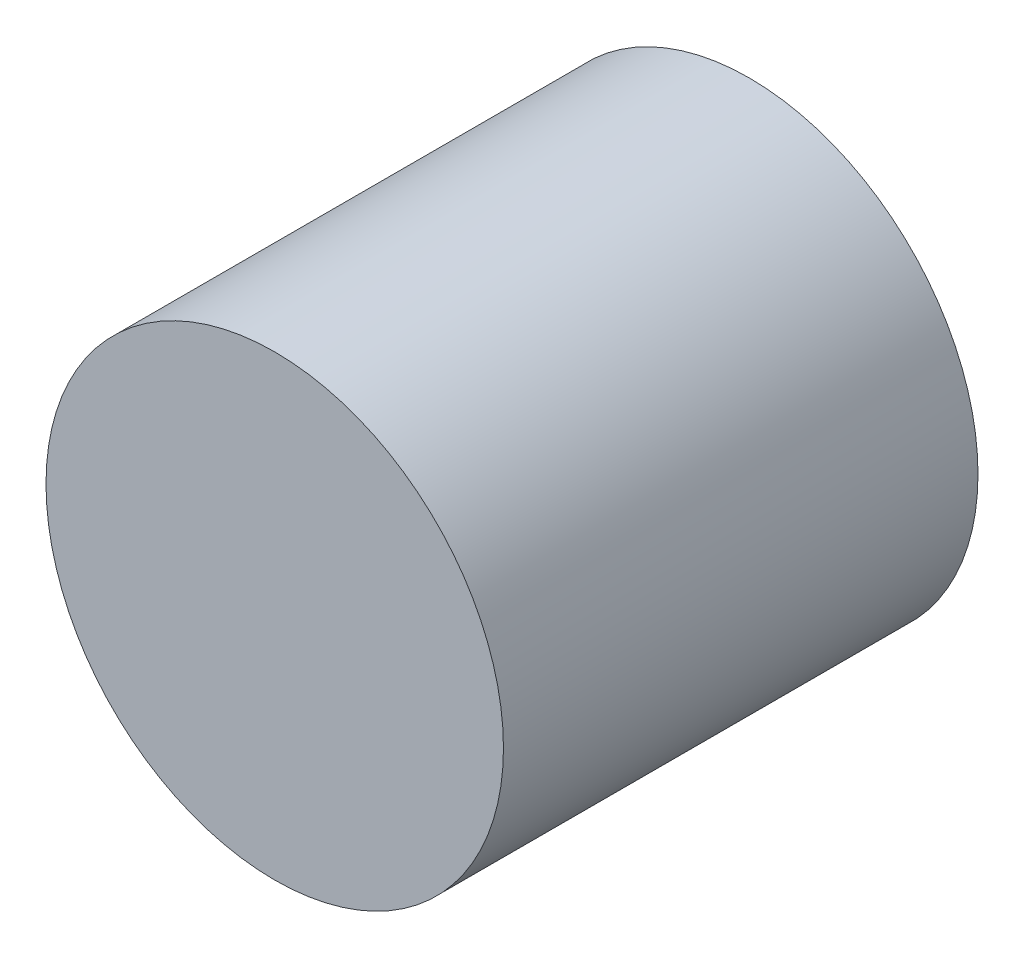
from build123d import *

# Parameters (mm, degrees)
SKETCH1_R           = 24.485925976
BOSS_EXTRUDE1_DEPTH = 50.8


with BuildPart() as part:
    # Sketch1 → Boss-Extrude1 (new body)
    with BuildSketch(Plane.XY):
        Circle(SKETCH1_R)
    extrude(amount=BOSS_EXTRUDE1_DEPTH)


solid = part.part
